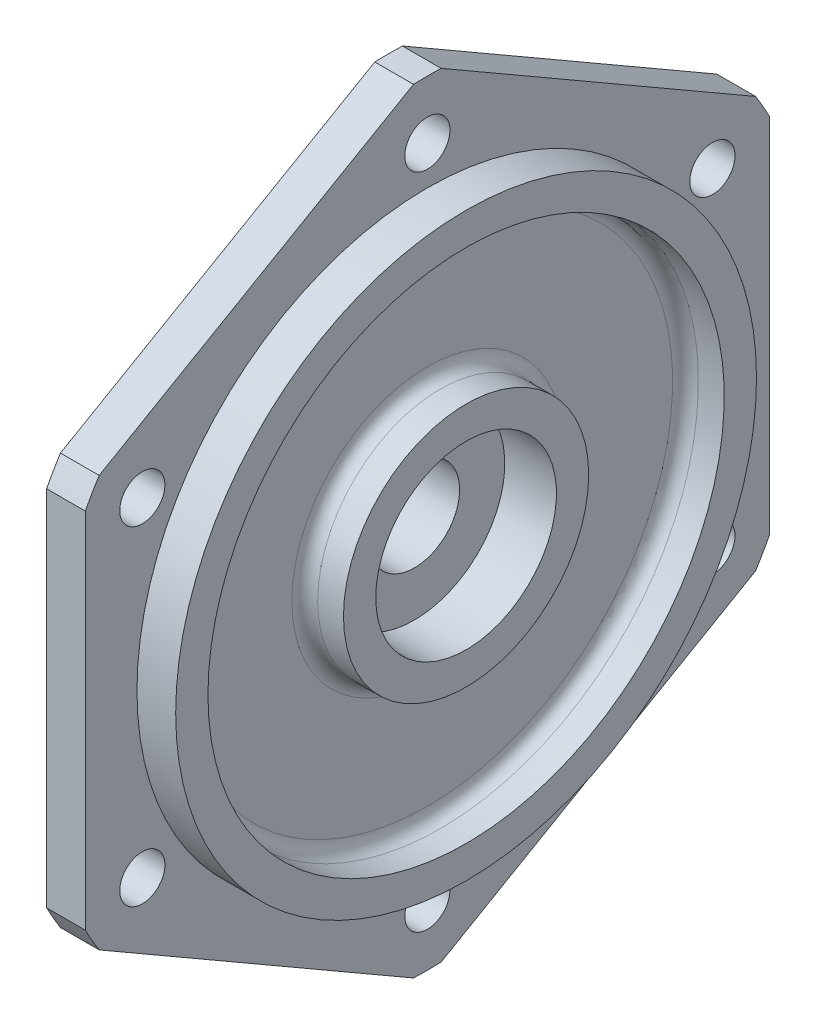
from build123d import *

# Parameters (mm, degrees)
SKETCH2_R          = 3.5
CUT_EXTRUDE1_DEPTH = 10
FILLET1_R          = 2
CUT_EXTRUDE2_START = -10
CUT_EXTRUDE2_DEPTH = 10


with BuildPart() as part:
    # Sketch1 → Revolve1 (revolve)
    with BuildSketch(Plane.XY, mode=Mode.PRIVATE) as revolve1_sk:
        Polygon((-8, 7), (-8, 23), (-4, 23), (-4, 60), (2, 60), (2, 45), (8, 45), (8, 40), (2, 40), (2, 19), (8, 19), (8, 14), (0, 14), (0, 7), align=None)
    revolve(revolve1_sk.sketch.rotate(Axis((0, 0, 0), (1, 0, 0)), 90), axis=Axis((0, 0, 0), (1, 0, 0)))

    # Sketch2 → Cut-Extrude1 (cut)
    with BuildSketch(Plane(origin=(2, 0, 0), x_dir=(0, 0, -1), z_dir=(1, 0, 0))):
        with Locations((0, 51)):
            Circle(SKETCH2_R)
        with Locations((44.167295593, 25.5)):
            Circle(SKETCH2_R)
        with Locations((44.167295593, -25.5)):
            Circle(SKETCH2_R)
        with Locations((0, -51)):
            Circle(SKETCH2_R)
        with Locations((-44.167295593, -25.5)):
            Circle(SKETCH2_R)
        with Locations((-44.167295593, 25.5)):
            Circle(SKETCH2_R)
    extrude(amount=-CUT_EXTRUDE1_DEPTH, mode=Mode.SUBTRACT)

    # Fillet1
    fillet1_edges = [part.edges().sort_by_distance(p)[0] for p in [
        (2, 0, -19),
        (2, 0, -40),
        (-4, 0, -23),
    ]]
    fillet(fillet1_edges, radius=FILLET1_R)

    # Sketch3 → Cut-Extrude2 (cut)
    with BuildSketch(Plane.ZY.offset(4).offset(CUT_EXTRUDE2_START)):
        with BuildLine():
            ThreePointArc((-2.143276082, 59.961707511), (-30, 51.961524227), (-50.856723918, 31.83698529))
            Line((-50.856723918, 31.83698529), (-2.143276082, 59.961707511))
        make_face()
        with BuildLine():
            ThreePointArc((50.856723918, 31.83698529), (30, 51.961524227), (2.143276082, 59.961707511))
            Line((2.143276082, 59.961707511), (50.856723918, 31.83698529))
        make_face()
        with BuildLine():
            ThreePointArc((60, 0), (58.223706512, 14.491376746), (53, 28.124722221))
            Line((53, 28.124722221), (53, -28.124722221))
            ThreePointArc((53, -28.124722221), (58.223706512, -14.491376746), (60, 0))
        make_face()
        with BuildLine():
            Line((50.856723918, -31.83698529), (2.143276082, -59.961707511))
            ThreePointArc((2.143276082, -59.961707511), (30, -51.961524227), (50.856723918, -31.83698529))
        make_face()
        with BuildLine():
            Line((-2.143276082, -59.961707511), (-50.856723918, -31.83698529))
            ThreePointArc((-50.856723918, -31.83698529), (-30, -51.961524227), (-2.143276082, -59.961707511))
        make_face()
        with BuildLine():
            Line((-53, -28.124722221), (-53, 28.124722221))
            ThreePointArc((-53, 28.124722221), (-60, 0), (-53, -28.124722221))
        make_face()
    extrude(amount=CUT_EXTRUDE2_DEPTH, mode=Mode.SUBTRACT)


solid = part.part
